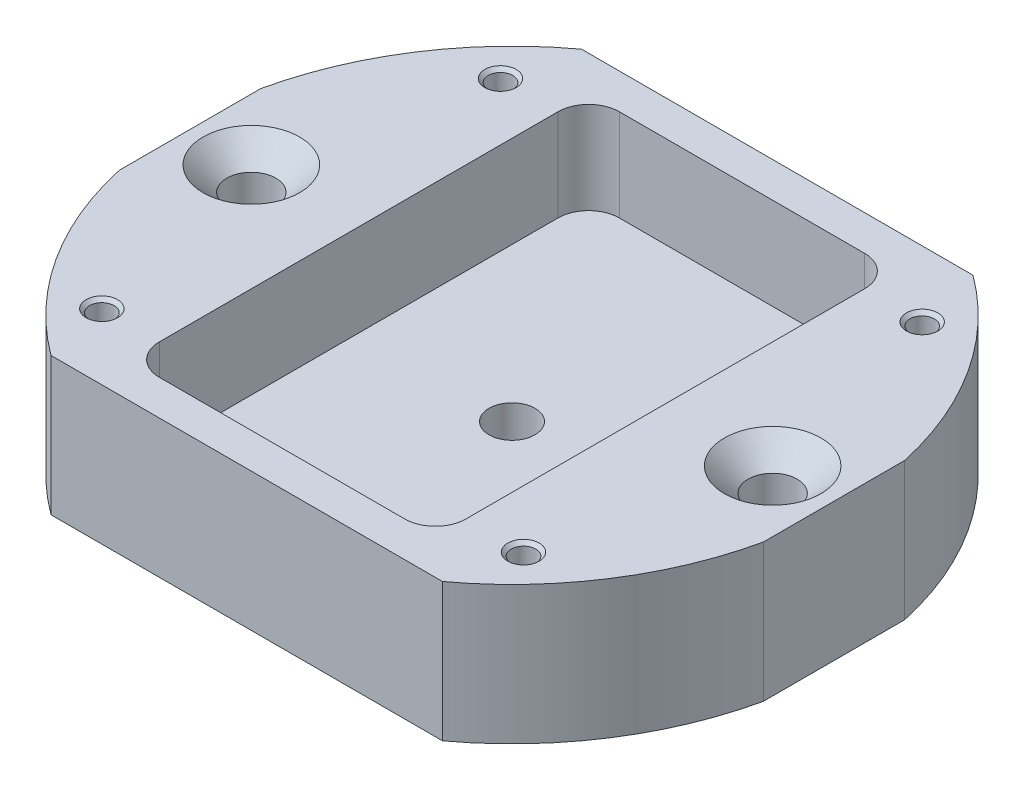
from build123d import *

# Parameters (mm, degrees)
SKIZZE1_W                                            = 42
SKIZZE1_H                                            = 34.6
AUFSATZ_LINEAR_AUSTRAGEN1_DEPTH                      = 9
FORMSENKUNG_F_R_M3_SENKSCHRAUBE_MIT_SCHL_D           = 3.2
FORMSENKUNG_F_R_M3_SENKSCHRAUBE_MIT_SCHL_DEPTH       = 12.4
FORMSENKUNG_F_R_M3_SENKSCHRAUBE_MIT_SCHL_CSINK_D     = 6.3
FORMSENKUNG_F_R_M3_SENKSCHRAUBE_MIT_SCHL_CSINK_ANGLE = 90
FORMSENKUNG_F_R_M3_SENKSCHRAUBE_MIT_SCHL_TIP         = 0.96137699
SKIZZE17_W                                           = 20
SKIZZE17_H                                           = 30
SCHNITT_LINEAR_AUSTRAGEN2_DEPTH                      = 6
M2_GEWINDEBOHRUNG3_D                                 = 1.6
M2_GEWINDEBOHRUNG3_DEPTH                             = 6
M2_GEWINDEBOHRUNG3_CSINK_D                           = 2.05
M2_GEWINDEBOHRUNG3_CSINK_ANGLE                       = 90
M2_GEWINDEBOHRUNG3_TIP                               = 0.480688495
VERRUNDUNG2_R                                        = 2
F_3_0_3_DURCHMESSER_BOHRUNG3_D                       = 3
SCHNITT_LINEAR_AUSTRAGEN_D_NN1_DEPTH                 = 10
SCHNITT_LINEAR_AUSTRAGEN_D_NN1_DEPTH_BACK            = 10
SKIZZE24_R                                           = 31.5
SKIZZE24_R_2                                         = 21.5


with BuildPart() as part:
    # Skizze1 → Aufsatz-Linear austragen1 (new body)
    with BuildSketch(Plane(origin=(0, 0, 0), x_dir=(1, 0, 0), z_dir=(0, 1, 0))):
        Rectangle(SKIZZE1_W, SKIZZE1_H)
    extrude(amount=AUFSATZ_LINEAR_AUSTRAGEN1_DEPTH)

    # Formsenkung für M3 Senkschraube mit Schlitz/Kreuzschlitz1
    with Locations(Plane(origin=(0, 9, 0), x_dir=(1, 0, 0), z_dir=(0, 1, 0))):
        with Locations((-17, 0), (17, 0)):
            CounterSinkHole(FORMSENKUNG_F_R_M3_SENKSCHRAUBE_MIT_SCHL_D / 2, FORMSENKUNG_F_R_M3_SENKSCHRAUBE_MIT_SCHL_CSINK_D / 2, depth=FORMSENKUNG_F_R_M3_SENKSCHRAUBE_MIT_SCHL_DEPTH, counter_sink_angle=FORMSENKUNG_F_R_M3_SENKSCHRAUBE_MIT_SCHL_CSINK_ANGLE)
            with Locations((0, 0, -(FORMSENKUNG_F_R_M3_SENKSCHRAUBE_MIT_SCHL_DEPTH + FORMSENKUNG_F_R_M3_SENKSCHRAUBE_MIT_SCHL_TIP / 2))):  # 118° drill point
                Cone(0, FORMSENKUNG_F_R_M3_SENKSCHRAUBE_MIT_SCHL_D / 2, FORMSENKUNG_F_R_M3_SENKSCHRAUBE_MIT_SCHL_TIP, mode=Mode.SUBTRACT)

    # Skizze17 → Schnitt-Linear austragen2 (cut)
    with BuildSketch(Plane(origin=(0, 9, 0), x_dir=(1, 0, 0), z_dir=(0, 1, 0))):
        Rectangle(SKIZZE17_W, SKIZZE17_H)
    extrude(amount=-SCHNITT_LINEAR_AUSTRAGEN2_DEPTH, mode=Mode.SUBTRACT)

    # M2 Gewindebohrung3
    with Locations(Plane(origin=(0, 9, 0), x_dir=(1, 0, 0), z_dir=(0, 1, 0))):
        with Locations((-13.75, 13), (13.75, 13), (13.75, -13), (-13.75, -13)):
            CounterSinkHole(M2_GEWINDEBOHRUNG3_D / 2, M2_GEWINDEBOHRUNG3_CSINK_D / 2, depth=M2_GEWINDEBOHRUNG3_DEPTH, counter_sink_angle=M2_GEWINDEBOHRUNG3_CSINK_ANGLE)
            with Locations((0, 0, -(M2_GEWINDEBOHRUNG3_DEPTH + M2_GEWINDEBOHRUNG3_TIP / 2))):  # 118° drill point
                Cone(0, M2_GEWINDEBOHRUNG3_D / 2, M2_GEWINDEBOHRUNG3_TIP, mode=Mode.SUBTRACT)

    # Verrundung2
    verrundung2_edges = [part.edges().sort_by_distance(p)[0] for p in [
        (-10, 6, 15),
        (-10, 6, -15),
        (10, 6, -15),
        (10, 6, 15),
    ]]
    fillet(verrundung2_edges, radius=VERRUNDUNG2_R)

    # Ø3.0 (3) Durchmesser Bohrung3 (through all)
    with Locations(Plane(origin=(0, 3, 0), x_dir=(1, 0, 0), z_dir=(0, 1, 0))):
        with Locations((0, 0)):
            Hole(F_3_0_3_DURCHMESSER_BOHRUNG3_D / 2)

    # Skizze24 → Schnitt-Linear-Austragen-Dünn1 (cut, two sides: drawn at the far end of the back side and taken through both)
    with BuildSketch(Plane.XZ.offset(-SCHNITT_LINEAR_AUSTRAGEN_D_NN1_DEPTH_BACK)):
        Circle(SKIZZE24_R)
        Circle(SKIZZE24_R_2, mode=Mode.SUBTRACT)
    extrude(amount=SCHNITT_LINEAR_AUSTRAGEN_D_NN1_DEPTH + SCHNITT_LINEAR_AUSTRAGEN_D_NN1_DEPTH_BACK, mode=Mode.SUBTRACT)


solid = part.part
